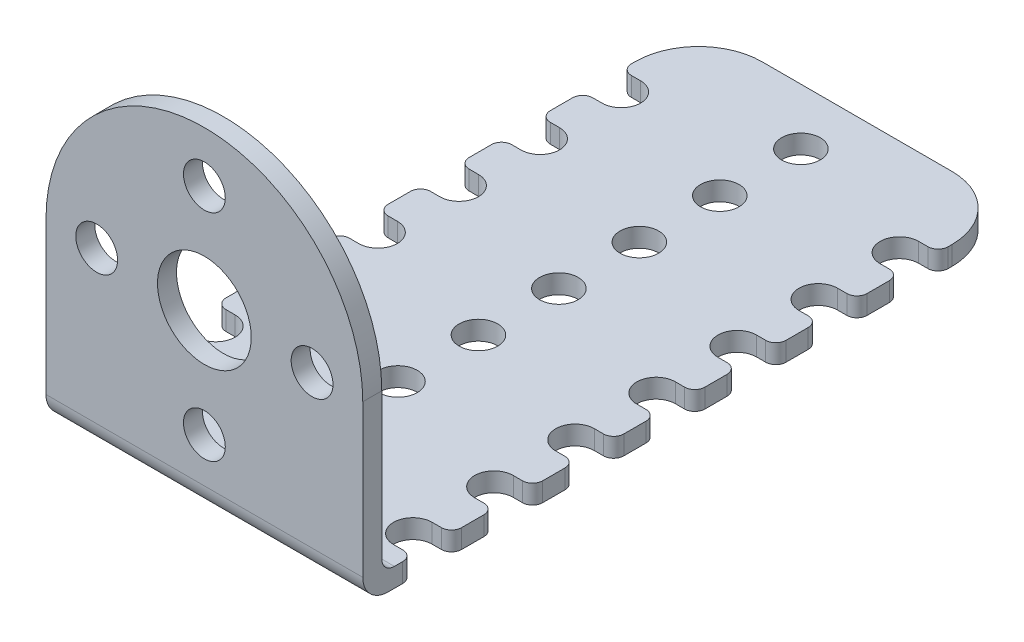
from build123d import *

# Parameters (mm, degrees)
ESBO_O1_W                = 25
ESBO_O1_H                = 51.5
RESSALTO_EXTRUS_O1_DEPTH = 1.5
ESBO_O4_W                = 25
ESBO_O4_H                = 1.5
RESSALTO_EXTRUS_O2_DEPTH = 25
ESBO_O5_R                = 1.65
ESBO_O5_R_2              = 3.7
CORTE_EXTRUS_O1_DEPTH    = 25
ESBO_O7_R                = 1.524
CORTE_EXTRUS_O2_DEPTH    = 25
FILETE1_R                = 5
FILETE2_R                = 2
FILETE3_R                = 1


with BuildPart() as part:
    # Esboço1 → Ressalto-extrusão1 (new body)
    with BuildSketch(Plane(origin=(0, 0, 0), x_dir=(1, 0, 0), z_dir=(0, 1, 0))):
        with Locations((12.5, 25.75)):
            Rectangle(ESBO_O1_W, ESBO_O1_H)
    extrude(amount=RESSALTO_EXTRUS_O1_DEPTH)

    # Esboço4 → Ressalto-extrusão2 (add)
    with BuildSketch(Plane(origin=(0, 1.5, 0), x_dir=(1, 0, 0), z_dir=(0, 1, 0))):
        with Locations((12.5, 0.75)):
            Rectangle(ESBO_O4_W, ESBO_O4_H)
    extrude(amount=RESSALTO_EXTRUS_O2_DEPTH)

    # Esboço5 → Corte-extrusão1 (cut)
    with BuildSketch(Plane.XY):
        with Locations((4, 14)):
            Circle(ESBO_O5_R)
        with BuildLine():
            ThreePointArc((0, 14), (3.661165235, 22.838834765), (12.5, 26.5))
            Line((12.5, 26.5), (0, 26.5))
            Line((0, 26.5), (0, 14))
        make_face()
        with Locations((12.5, 22.5)):
            Circle(ESBO_O5_R)
        with Locations((12.5, 14)):
            Circle(ESBO_O5_R_2)
        with Locations((21, 14)):
            Circle(ESBO_O5_R)
        with Locations((12.5, 5.5)):
            Circle(ESBO_O5_R)
        with BuildLine():
            ThreePointArc((12.5, 26.5), (21.338834765, 22.838834765), (25, 14))
            Line((25, 14), (25, 26.5))
            Line((25, 26.5), (12.5, 26.5))
        make_face()
    extrude(amount=-CORTE_EXTRUS_O1_DEPTH, mode=Mode.SUBTRACT)

    # Esboço7 → Corte-extrusão2 (cut)
    with BuildSketch(Plane(origin=(0, 1.5, 0), x_dir=(1, 0, 0), z_dir=(0, 1, 0))):
        with Locations(Location((12.5, 40.68, 0), (0, 0, 270))):
            Circle(ESBO_O7_R)
        with Locations(Location((12.5, 34.33, 0), (0, 0, 270))):
            Circle(ESBO_O7_R)
        with Locations(Location((12.5, 27.98, 0), (0, 0, 270))):
            Circle(ESBO_O7_R)
        with Locations(Location((12.5, 21.63, 0), (0, 0, 270))):
            Circle(ESBO_O7_R)
        with Locations(Location((12.5, 15.28, 0), (0, 0, 270))):
            Circle(ESBO_O7_R)
        with Locations(Location((12.5, 8.93, 0), (0, 0, 270))):
            Circle(ESBO_O7_R)
        with Locations(Location((12.5, 47.08, 0), (0, 0, 270))):
            Circle(ESBO_O7_R)
        with BuildLine():
            Line((1.524, 3.956), (0.8, 3.956))
            ThreePointArc((0.8, 3.956), (0.234314575, 3.721685425), (0, 3.156))
            Line((0, 3.156), (0, 7.804))
            ThreePointArc((0, 7.804), (0.234314575, 7.238314575), (0.8, 7.004))
            Line((0.8, 7.004), (1.524, 7.004))
            ThreePointArc((1.524, 7.004), (3.048, 5.48), (1.524, 3.956))
        make_face()
        with BuildLine():
            Line((23.476, 45.404), (24.2, 45.404))
            ThreePointArc((24.2, 45.404), (24.765685425, 45.638314575), (25, 46.204))
            Line((25, 46.204), (25, 41.556))
            ThreePointArc((25, 41.556), (24.765685425, 42.121685425), (24.2, 42.356))
            Line((24.2, 42.356), (23.476, 42.356))
            ThreePointArc((23.476, 42.356), (21.952, 43.88), (23.476, 45.404))
        make_face()
        with BuildLine():
            Line((25, 35.156), (25, 39.804))
            ThreePointArc((25, 39.804), (24.765685425, 39.238314575), (24.2, 39.004))
            Line((24.2, 39.004), (23.476, 39.004))
            ThreePointArc((23.476, 39.004), (21.952, 37.48), (23.476, 35.956))
            Line((23.476, 35.956), (24.2, 35.956))
            ThreePointArc((24.2, 35.956), (24.765685425, 35.721685425), (25, 35.156))
        make_face()
        with BuildLine():
            Line((25, 28.756), (25, 33.404))
            ThreePointArc((25, 33.404), (24.765685425, 32.838314575), (24.2, 32.604))
            Line((24.2, 32.604), (23.476, 32.604))
            ThreePointArc((23.476, 32.604), (21.952, 31.08), (23.476, 29.556))
            Line((23.476, 29.556), (24.2, 29.556))
            ThreePointArc((24.2, 29.556), (24.765685425, 29.321685425), (25, 28.756))
        make_face()
        with BuildLine():
            Line((25, 22.356), (25, 27.004))
            ThreePointArc((25, 27.004), (24.765685425, 26.438314575), (24.2, 26.204))
            Line((24.2, 26.204), (23.476, 26.204))
            ThreePointArc((23.476, 26.204), (21.952, 24.68), (23.476, 23.156))
            Line((23.476, 23.156), (24.2, 23.156))
            ThreePointArc((24.2, 23.156), (24.765685425, 22.921685425), (25, 22.356))
        make_face()
        with BuildLine():
            Line((25, 15.956), (25, 20.604))
            ThreePointArc((25, 20.604), (24.765685425, 20.038314575), (24.2, 19.804))
            Line((24.2, 19.804), (23.476, 19.804))
            ThreePointArc((23.476, 19.804), (21.952, 18.28), (23.476, 16.756))
            Line((23.476, 16.756), (24.2, 16.756))
            ThreePointArc((24.2, 16.756), (24.765685425, 16.521685425), (25, 15.956))
        make_face()
        with BuildLine():
            Line((25, 9.556), (25, 14.204))
            ThreePointArc((25, 14.204), (24.765685425, 13.638314575), (24.2, 13.404))
            Line((24.2, 13.404), (23.476, 13.404))
            ThreePointArc((23.476, 13.404), (21.952, 11.88), (23.476, 10.356))
            Line((23.476, 10.356), (24.2, 10.356))
            ThreePointArc((24.2, 10.356), (24.765685425, 10.121685425), (25, 9.556))
        make_face()
        with BuildLine():
            Line((25, 3.156), (25, 7.804))
            ThreePointArc((25, 7.804), (24.765685425, 7.238314575), (24.2, 7.004))
            Line((24.2, 7.004), (23.476, 7.004))
            ThreePointArc((23.476, 7.004), (21.952, 5.48), (23.476, 3.956))
            Line((23.476, 3.956), (24.2, 3.956))
            ThreePointArc((24.2, 3.956), (24.765685425, 3.721685425), (25, 3.156))
        make_face()
        with BuildLine():
            Line((1.524, 10.356), (0.8, 10.356))
            ThreePointArc((0.8, 10.356), (0.234314575, 10.121685425), (0, 9.556))
            Line((0, 9.556), (0, 14.204))
            ThreePointArc((0, 14.204), (0.234314575, 13.638314575), (0.8, 13.404))
            Line((0.8, 13.404), (1.524, 13.404))
            ThreePointArc((1.524, 13.404), (3.048, 11.88), (1.524, 10.356))
        make_face()
        with BuildLine():
            Line((1.524, 16.756), (0.8, 16.756))
            ThreePointArc((0.8, 16.756), (0.234314575, 16.521685425), (0, 15.956))
            Line((0, 15.956), (0, 20.604))
            ThreePointArc((0, 20.604), (0.234314575, 20.038314575), (0.8, 19.804))
            Line((0.8, 19.804), (1.524, 19.804))
            ThreePointArc((1.524, 19.804), (3.048, 18.28), (1.524, 16.756))
        make_face()
        with BuildLine():
            Line((1.524, 23.156), (0.8, 23.156))
            ThreePointArc((0.8, 23.156), (0.234314575, 22.921685425), (0, 22.356))
            Line((0, 22.356), (0, 27.004))
            ThreePointArc((0, 27.004), (0.234314575, 26.438314575), (0.8, 26.204))
            Line((0.8, 26.204), (1.524, 26.204))
            ThreePointArc((1.524, 26.204), (3.048, 24.68), (1.524, 23.156))
        make_face()
        with BuildLine():
            Line((1.524, 29.556), (0.8, 29.556))
            ThreePointArc((0.8, 29.556), (0.234314575, 29.321685425), (0, 28.756))
            Line((0, 28.756), (0, 33.404))
            ThreePointArc((0, 33.404), (0.234314575, 32.838314575), (0.8, 32.604))
            Line((0.8, 32.604), (1.524, 32.604))
            ThreePointArc((1.524, 32.604), (3.048, 31.08), (1.524, 29.556))
        make_face()
        with BuildLine():
            Line((1.524, 35.956), (0.8, 35.956))
            ThreePointArc((0.8, 35.956), (0.234314575, 35.721685425), (0, 35.156))
            Line((0, 35.156), (0, 39.804))
            ThreePointArc((0, 39.804), (0.234314575, 39.238314575), (0.8, 39.004))
            Line((0.8, 39.004), (1.524, 39.004))
            ThreePointArc((1.524, 39.004), (3.048, 37.48), (1.524, 35.956))
        make_face()
        with BuildLine():
            Line((0, 41.556), (0, 46.204))
            ThreePointArc((0, 46.204), (0.234314575, 45.638314575), (0.8, 45.404))
            Line((0.8, 45.404), (1.524, 45.404))
            ThreePointArc((1.524, 45.404), (3.048, 43.88), (1.524, 42.356))
            Line((1.524, 42.356), (0.8, 42.356))
            ThreePointArc((0.8, 42.356), (0.234314575, 42.121685425), (0, 41.556))
        make_face()
    extrude(amount=-CORTE_EXTRUS_O2_DEPTH, mode=Mode.SUBTRACT)

    # Filete1
    filete1_edges = [part.edges().sort_by_distance(p)[0] for p in [
        (0, 0.75, -51.5),
        (25, 0.75, -51.5),
    ]]
    fillet(filete1_edges, radius=FILETE1_R)

    # Filete2
    filete2_edges = [part.edges().sort_by_distance(p)[0] for p in [
        (12.5, 0, 0),
    ]]
    fillet(filete2_edges, radius=FILETE2_R)

    # Filete3
    filete3_edges = [part.edges().sort_by_distance(p)[0] for p in [
        (12.5, 1.5, -1.5),
    ]]
    fillet(filete3_edges, radius=FILETE3_R)


solid = part.part
